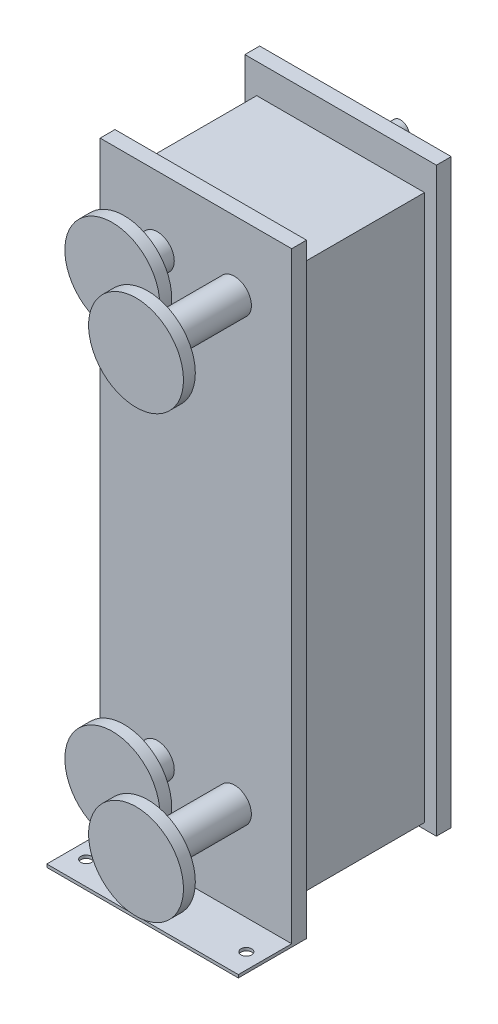
from build123d import *

# Parameters (mm, degrees)
SKETCH_1_W        = 323
SKETCH_1_H        = 1020
EXTRUDE_1_DEPTH   = 25
SKETCH_3_W        = 323
SKETCH_3_H        = 980
EXTRUDE_2_DEPTH   = 25
SKETCH_15_W       = 283
SKETCH_15_H       = 920
EXTRUDE3_DEPTH    = 219
SKETCH3_W         = 323
SKETCH3_H         = 90
SKETCH3_R         = 9
SKETCH3_W_2       = 34
SKETCH3_H_2       = 50
EXTRUDE6_DEPTH    = 5
SKETCH4_W         = 34
SKETCH4_H         = 105
EXTRUDE7_DEPTH    = 10
SKETCH5_R         = 15
EXTRUDE8_DEPTH    = 76
SKETCH_17_R       = 28.5
EXTRUDE_1_2_DEPTH = 76
SKETCH_18_R       = 80
EXTRUDE_2_2_DEPTH = 20
SKETCH_19_R       = 28.5
EXTRUDE_3_DEPTH   = 90
SKETCH_20_R       = 80
EXTRUDE_4_DEPTH   = 20


with BuildPart() as part:
    # Эскиз1 → Extrude 1 (new body)
    with BuildSketch(Plane.XY):
        Rectangle(SKETCH_1_W, SKETCH_1_H)
    extrude(amount=EXTRUDE_1_DEPTH)



with BuildPart() as body_2:
    # Эскиз3 → Extrude 2 (new body)
    with BuildSketch(Plane(origin=(0, 0, -219), x_dir=(-1, 0, 0), z_dir=(0, 0, -1))):
        with Locations((0, 20)):
            Rectangle(SKETCH_3_W, SKETCH_3_H)
    extrude(amount=EXTRUDE_2_DEPTH)


with BuildPart() as part_1:
    add(part.part)

    add(body_2.part)  # Extrude3 merges body 2
    # Эскиз15 → Extrude3 (add)
    with BuildSketch(Plane(origin=(0, 0, 0), x_dir=(-1, 0, 0), z_dir=(0, 0, -1))):
        Rectangle(SKETCH_15_W, SKETCH_15_H)
    extrude(amount=EXTRUDE3_DEPTH)

    # Sketch3 → Extrude6 (add)
    # profile 1 of 2: a face of its own
    with BuildSketch(Plane.XZ.offset(510)):
        with Locations((0, 70)):
            Rectangle(SKETCH3_W, SKETCH3_H)
        with Locations(Location((-135, 75, 0), (0, 0, 270))):
            Circle(SKETCH3_R, mode=Mode.SUBTRACT)
        with Locations(Location((135, 75, 0), (0, 0, 270))):
            Circle(SKETCH3_R, mode=Mode.SUBTRACT)
    # profile 2 of 2: a face of its own
    with BuildSketch(Plane.XZ.offset(510)):
        with Locations((0, -355)):
            Rectangle(SKETCH3_W_2, SKETCH3_H_2)
        with Locations(Location((0, -355, 0), (0, 0, 270))):
            Circle(SKETCH3_R, mode=Mode.SUBTRACT)
    extrude(amount=-EXTRUDE6_DEPTH)


with BuildPart() as extrude6_piece_1:
    # of the separate pieces the step leaves, piece 1, a body of its own (extrude6_pieces)
    add(part_1.part.solids().sort_by_distance((161.5, 510, -219))[0])



with BuildPart() as extrude6_piece_2:
    # of the separate pieces the step leaves, piece 2, a body of its own (extrude6_pieces)
    add(part_1.part.solids().sort_by_distance((-17, -510, -380))[0])

    # Sketch4 → Extrude7 (add)
    with BuildSketch(Plane.XY.offset(-330)):
        with Locations((0, -457.5)):
            Rectangle(SKETCH4_W, SKETCH4_H)
    extrude(amount=EXTRUDE7_DEPTH)


with BuildPart() as extrude6_piece_1_1:
    add(extrude6_piece_1.part)

    add(extrude6_piece_2.part)  # Extrude8 merges Extrude6 piece 2
    # Sketch5 → Extrude8 (add)
    with BuildSketch(Plane(origin=(0, 0, -244), x_dir=(-1, 0, 0), z_dir=(0, 0, -1))):
        with Locations(Location((0, -420, 0), (0, 0, 90))):
            Circle(SKETCH5_R)
        with Locations((0, 430)):
            Circle(SKETCH5_R)
    extrude(amount=EXTRUDE8_DEPTH)

    # Эскиз17 → Extrude 1 2 (add)
    with BuildSketch(Plane.XY.offset(25)):
        with Locations((-65, -350)):
            Circle(SKETCH_17_R)
        with Locations((65, -350)):
            Circle(SKETCH_17_R)
        with Locations((-65, 393)):
            Circle(SKETCH_17_R)
        with Locations((65, 393)):
            Circle(SKETCH_17_R)
    extrude(amount=EXTRUDE_1_2_DEPTH)

    # Эскиз18 → Extrude 2 2 (add)
    with BuildSketch(Plane.XY.offset(101)):
        with Locations((-65, 393)):
            Circle(SKETCH_18_R)
        with Locations((-65, -350)):
            Circle(SKETCH_18_R)
    extrude(amount=-EXTRUDE_2_2_DEPTH)

    # Эскиз19 → Бобышка-Вытянуть3 (add)
    with BuildSketch(Plane.XY.offset(101)):
        with Locations((65, 393)):
            Circle(SKETCH_19_R)
        with Locations((65, -350)):
            Circle(SKETCH_19_R)
    extrude(amount=EXTRUDE_3_DEPTH)

    # Эскиз20 → Бобышка-Вытянуть4 (add)
    with BuildSketch(Plane.XY.offset(191)):
        with Locations((65, 393)):
            Circle(SKETCH_20_R)
        with Locations((65, -350)):
            Circle(SKETCH_20_R)
    extrude(amount=-EXTRUDE_4_DEPTH)


solid = extrude6_piece_1_1.part
